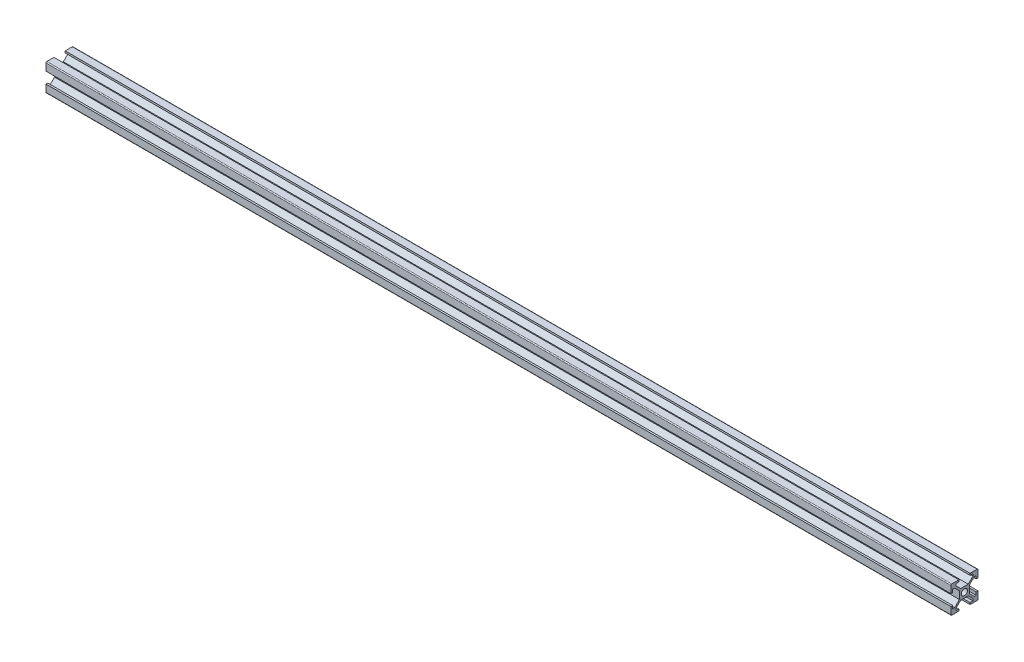
from build123d import *

# Parameters (mm, degrees)
EXTRUDE_1_DEPTH          = 500
CUT_EXTRUDE_2_DEPTH      = 501.112487347
CUT_EXTRUDE_2_DEPTH_BACK = 501.112487347
SKETCH_2_4_R             = 1.65


with BuildPart() as part:
    # 草图2 → 凸台-拉伸1 (new body)
    with BuildSketch(Plane(origin=(0, 0, 0), x_dir=(0, 0, -1), z_dir=(1, 0, 0))):
        with BuildLine():
            Line((-7, 7.5), (7, 7.5))
            ThreePointArc((7, 7.5), (7.353553391, 7.353553391), (7.5, 7))
            Line((7.5, 7), (7.5, -7))
            ThreePointArc((7.5, -7), (7.353553391, -7.353553391), (7, -7.5))
            Line((7, -7.5), (-7, -7.5))
            ThreePointArc((-7, -7.5), (-7.353553391, -7.353553391), (-7.5, -7))
            Line((-7.5, -7), (-7.5, 7))
            ThreePointArc((-7.5, 7), (-7.353553391, 7.353553391), (-7, 7.5))
        make_face()
    extrude(amount=EXTRUDE_1_DEPTH)

    # 草图2<4> → 切除-拉伸2 (cut, two sides: drawn at the far end of the back side and taken through both)
    with BuildSketch(Plane(origin=(0, 0, 0), x_dir=(0, 0, -1), z_dir=(1, 0, 0)).offset(-CUT_EXTRUDE_2_DEPTH_BACK)):
        Polygon((3.1, 7.5), (-3.1, 7.5), (-3.1, 6.5), (-4.7, 6.5), (-4.7, 5.407106781), (-2.092893219, 2.8), (2.092893219, 2.8), (4.7, 5.407106781), (4.7, 6.5), (3.1, 6.5), align=None)
        Polygon((-6.5, 3.1), (-7.5, 3.1), (-7.5, -3.1), (-6.5, -3.1), (-6.5, -4.7), (-5.407106781, -4.7), (-2.8, -2.092893219), (-2.8, 2.092893219), (-5.407106781, 4.7), (-6.5, 4.7), align=None)
        Polygon((7.5, -3.1), (7.5, 3.1), (6.5, 3.1), (6.5, 4.7), (5.407106781, 4.7), (2.8, 2.092893219), (2.8, -2.092893219), (5.407106781, -4.7), (6.5, -4.7), (6.5, -3.1), align=None)
        Polygon((-3.1, -6.5), (-3.1, -7.5), (3.1, -7.5), (3.1, -6.5), (4.7, -6.5), (4.7, -5.407106781), (2.092893219, -2.8), (-2.092893219, -2.8), (-4.7, -5.407106781), (-4.7, -6.5), align=None)
        Circle(SKETCH_2_4_R)
    extrude(amount=CUT_EXTRUDE_2_DEPTH + CUT_EXTRUDE_2_DEPTH_BACK, mode=Mode.SUBTRACT)


solid = part.part
